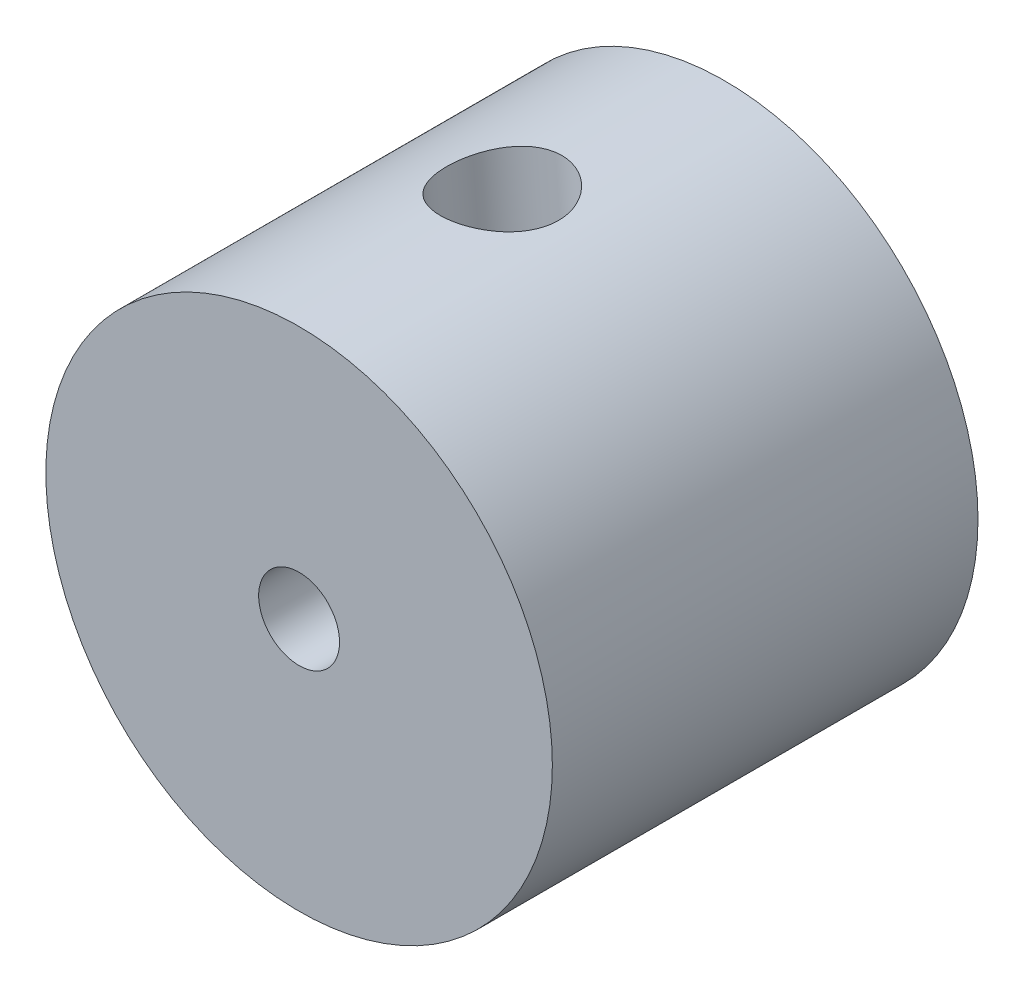
from build123d import *

# Parameters (mm, degrees)
SKETCH1_R                   = 5.95
BOSS_EXTRUDE2_DEPTH         = 10
SKETCH12_R                  = 0.95
CUT_EXTRUDE3_DEPTH          = 10
F_37_0_104_DIAMETER_HOLE1_D = 2.6416


with BuildPart() as part:
    # Sketch1 → Boss-Extrude2 (new body)
    with BuildSketch(Plane.XY):
        with Locations((-101.724686529, 42.083000392)):
            Circle(SKETCH1_R)
    extrude(amount=BOSS_EXTRUDE2_DEPTH)

    # Sketch12 → Cut-Extrude3 (cut)
    with BuildSketch(Plane.XY.offset(10)):
        with Locations((-101.724686529, 42.083000392)):
            Circle(SKETCH12_R)
    extrude(amount=-CUT_EXTRUDE3_DEPTH, mode=Mode.SUBTRACT)

    # #37 (0.104) Diameter Hole1 (through all)
    with Locations(Plane(origin=(-101.228935977, 36.153689185, 4.736849069), x_dir=(-0.996522891944, -0.083319420496, 0), z_dir=(0.083319420496, -0.996522891944, 0))):
        with Locations((0, 0)):
            Hole(F_37_0_104_DIAMETER_HOLE1_D / 2)


solid = part.part
